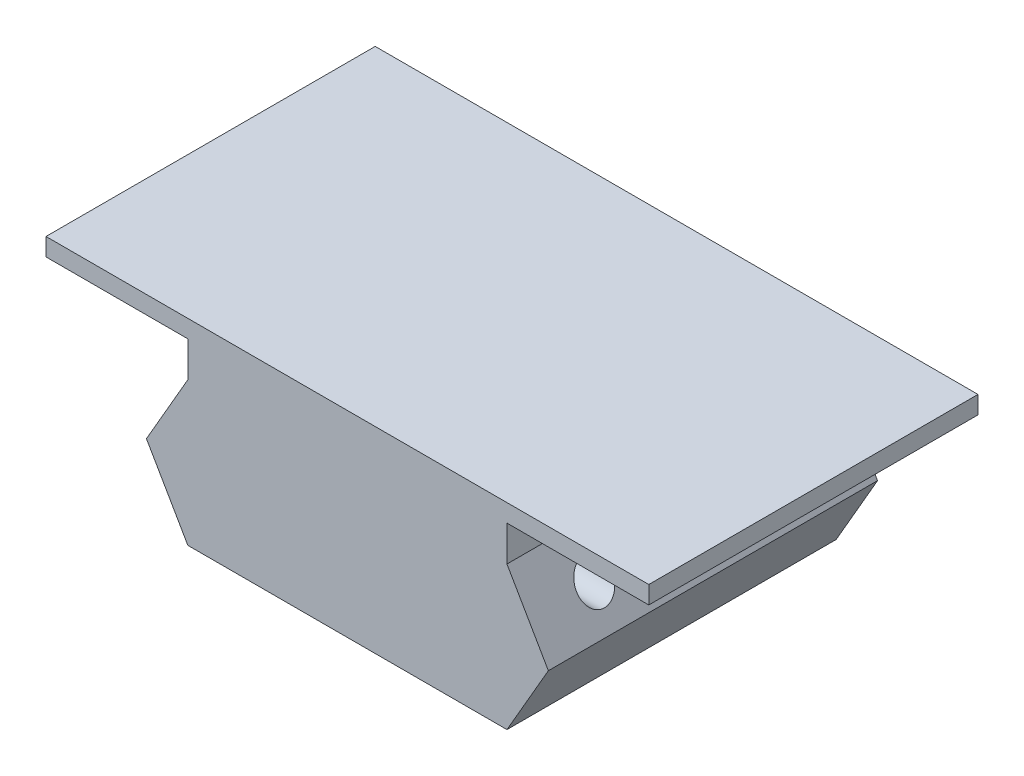
from build123d import *

# Parameters (mm, degrees)
BOSS_EXTRUDE1_DEPTH     = 18.568445
CUT_EXTRUDE1_DEPTH      = 28.942587158
CUT_EXTRUDE1_DEPTH_BACK = 28.942587158
SKETCH2_R               = 1


with BuildPart() as part:
    # Sketch1 → Boss-Extrude1 (new body)
    with BuildSketch(Plane.XY):
        Polygon((9.693000417, 0), (-8.306999583, 0), (-10.641999583, 4.044338636), (-8.306999583, 8.088677271), (-8.306999583, 10.088677271), (-16.306999583, 10.088677271), (-16.306999583, 11.088677271), (17.693000417, 11.088677271), (17.693000417, 10.088677271), (9.693000417, 10.088677271), (9.693000417, 8.088677271), (12.028000417, 4.044338636), align=None)
    extrude(amount=-BOSS_EXTRUDE1_DEPTH)

    # Sketch2 → Cut-Extrude1 (cut, two sides: drawn at the far end of the back side and taken through both)
    with BuildSketch(Plane(origin=(0, 0, 0), x_dir=(0, 0, -1), z_dir=(1, 0, 0)).offset(-CUT_EXTRUDE1_DEPTH_BACK)):
        with Locations(Location((3.71, 5.988677271, 0), (0, 0, 90))):
            Circle(SKETCH2_R)
        with Locations(Location((7.42, 5.988677271, 0), (0, 0, 90))):
            Circle(SKETCH2_R)
        with Locations(Location((11.13, 5.988677271, 0), (0, 0, 90))):
            Circle(SKETCH2_R)
        with Locations(Location((14.84, 5.988677271, 0), (0, 0, 90))):
            Circle(SKETCH2_R)
    extrude(amount=CUT_EXTRUDE1_DEPTH + CUT_EXTRUDE1_DEPTH_BACK, mode=Mode.SUBTRACT)


solid = part.part
